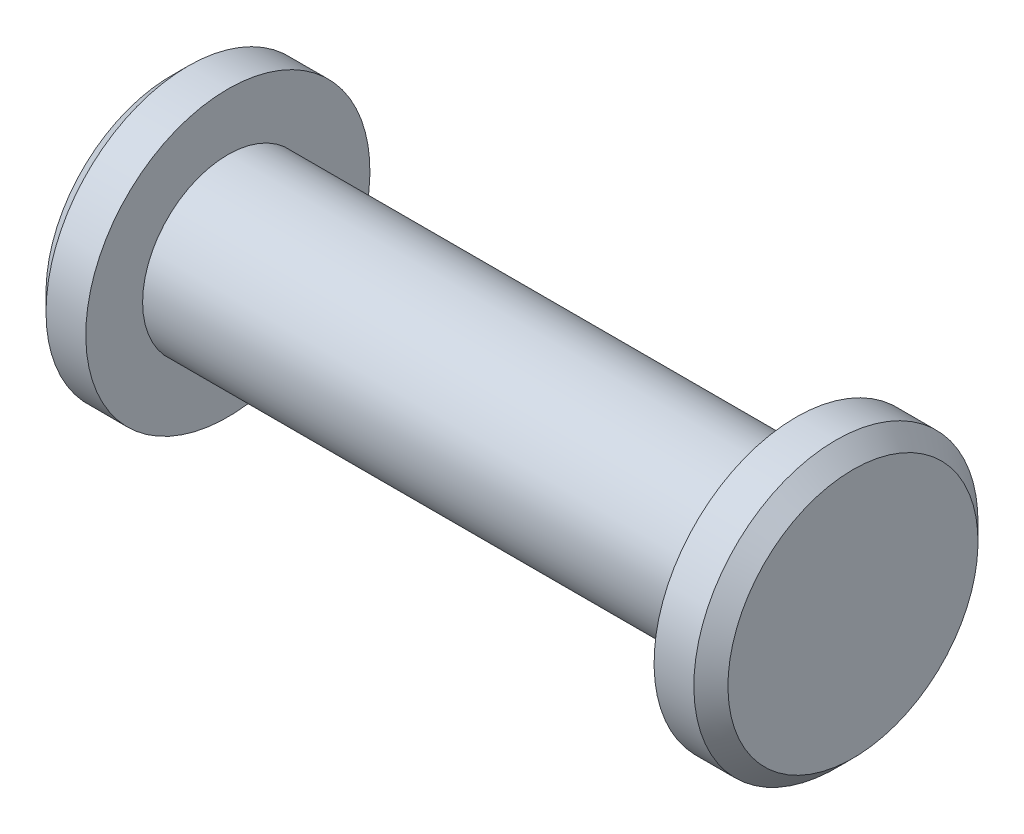
from build123d import *

# Parameters (mm, degrees)
CHAMFER1_SIZE = 3


with BuildPart() as part:
    # Sketch1 → Revolve1 (revolve)
    with BuildSketch(Plane.XY):
        Polygon((-120, 0), (-120, 25), (-110, 25), (-110, 15), (-10, 15), (-10, 25), (0, 25), (0, 0), align=None)
    revolve(axis=Axis((0, 0, 0), (-1, 0, 0)))

    # Chamfer1
    chamfer1_edges = [part.edges().sort_by_distance(p)[0] for p in [
        (0, -25, 0),
        (-120, -25, 0),
    ]]
    chamfer(chamfer1_edges, length=CHAMFER1_SIZE)


solid = part.part
